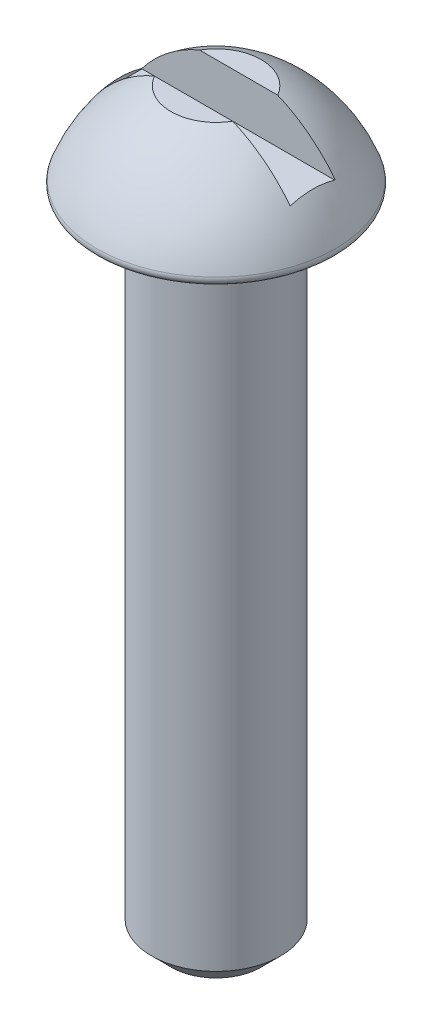
from build123d import *

# Parameters (mm, degrees)
FILLET_1_R          = 0.1
SKETCH_2_W          = 3
SKETCH_2_H          = 0.7
CUT_EXTRUDE_1_DEPTH = 0.7


with BuildPart() as part:
    # Эскиз1 → Повернуть1 (revolve)
    with BuildSketch(Plane.XY):
        with BuildLine():
            Line((1.9, 10.1), (1, 10.1))
            Line((1, 10.1), (1, 0.3))
            Line((1, 0.3), (0.7, 0))
            Line((0.7, 0), (0, 0))
            Line((0, 0), (0, 11.5))
            Line((0, 11.5), (0.7, 11.5))
            ThreePointArc((0.7, 11.5), (1.445839439, 10.925005233), (1.9, 10.1))
        make_face()
    revolve(axis=Axis((0, 0, 0), (0, 1, 0)))

    # Скругление1
    fillet_1_edges = [part.edges().sort_by_distance(p)[0] for p in [
        (-1.9, 10.1, 0),
    ]]
    fillet(fillet_1_edges, radius=FILLET_1_R)

    # Эскиз2 → Вырез-Вытянуть1 (cut)
    with BuildSketch(Plane(origin=(0, 11.5, 0), x_dir=(-1, 0, 0), z_dir=(0, 1, 0))):
        Rectangle(SKETCH_2_W, SKETCH_2_H)
    extrude(amount=-CUT_EXTRUDE_1_DEPTH, mode=Mode.SUBTRACT)


solid = part.part
